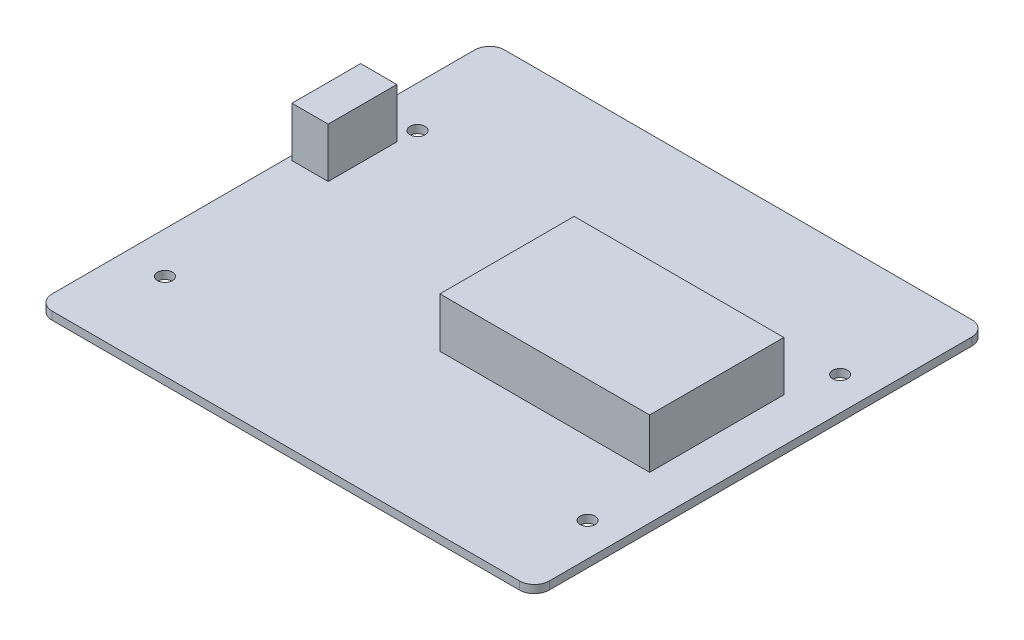
from build123d import *

# Parameters (mm, degrees)
SKETCH_1_R      = 1.5
EXTRUDE_1_DEPTH = 1.6
SKETCH_2_W      = 42.186521795
SKETCH_2_H      = 26.994351744
SKETCH_2_W_2    = 7.282197215
SKETCH_2_H_2    = 13.811063683
EXTRUDE_2_DEPTH = 10


with BuildPart() as part:
    # 草图1 → 凸台-拉伸1 (new body)
    with BuildSketch(Plane(origin=(0, 0, 0), x_dir=(1, 0, 0), z_dir=(0, 1, 0))):
        with BuildLine():
            Line((-47, 45.5), (47, 45.5))
            ThreePointArc((47, 45.5), (49.121320344, 44.621320344), (50, 42.5))
            Line((50, 42.5), (50, -42.5))
            ThreePointArc((50, -42.5), (49.121320344, -44.621320344), (47, -45.5))
            Line((47, -45.5), (-47, -45.5))
            ThreePointArc((-47, -45.5), (-49.121320344, -44.621320344), (-50, -42.5))
            Line((-50, -42.5), (-50, 42.5))
            ThreePointArc((-50, 42.5), (-49.121320344, 44.621320344), (-47, 45.5))
        make_face()
        with Locations(Location((-41.7, 22.7, 0), (0, 0, 270))):
            Circle(SKETCH_1_R, mode=Mode.SUBTRACT)
        with Locations(Location((43.3, 22.7, 0), (0, 0, 270))):
            Circle(SKETCH_1_R, mode=Mode.SUBTRACT)
        with Locations(Location((43.3, -28.1, 0), (0, 0, 270))):
            Circle(SKETCH_1_R, mode=Mode.SUBTRACT)
        with Locations(Location((-41.7, -28.1, 0), (0, 0, 270))):
            Circle(SKETCH_1_R, mode=Mode.SUBTRACT)
    extrude(amount=EXTRUDE_1_DEPTH)

    # 草图2 → 凸台-拉伸2 (add)
    with BuildSketch(Plane(origin=(0, 1.6, 0), x_dir=(1, 0, 0), z_dir=(0, 1, 0))):
        with Locations((20.088819902, 0)):
            Rectangle(SKETCH_2_W, SKETCH_2_H)
        with Locations((-45.45095503, 11.739404131)):
            Rectangle(SKETCH_2_W_2, SKETCH_2_H_2)
    extrude(amount=EXTRUDE_2_DEPTH)


solid = part.part
